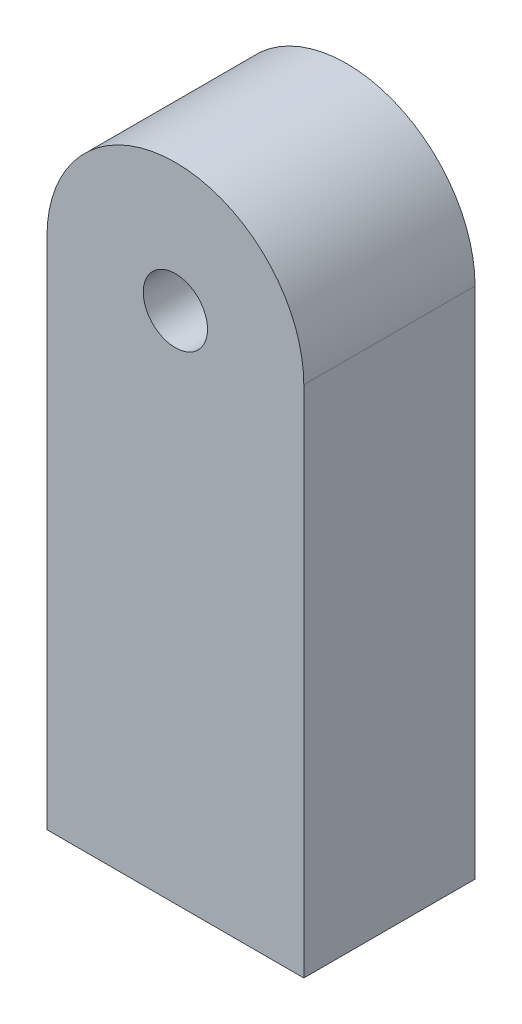
from build123d import *

# Parameters (mm, degrees)
SKETCH2_W           = 38.1
SKETCH2_H           = 25.4
BOSS_EXTRUDE1_DEPTH = 76.2
SKETCH3_W           = 19.05
SKETCH3_H           = 25.4
REVOLVE1_ANGLE      = 180
SKETCH4_R           = 4.7625
CUT_EXTRUDE1_DEPTH  = 101.40231571


with BuildPart() as part:
    # Sketch2 → Boss-Extrude1 (new body)
    with BuildSketch(Plane(origin=(0, 0, 0), x_dir=(1, 0, 0), z_dir=(0, 1, 0))):
        Rectangle(SKETCH2_W, SKETCH2_H)
    extrude(amount=BOSS_EXTRUDE1_DEPTH)

    # Sketch3 → Revolve1 (revolve)
    with BuildSketch(Plane(origin=(0, 76.2, 0), x_dir=(1, 0, 0), z_dir=(0, 1, 0))):
        with Locations((9.525, 0)):
            Rectangle(SKETCH3_W, SKETCH3_H)
    revolve(axis=Axis((0, 76.2, -12.7), (0, 0, 1)), revolution_arc=REVOLVE1_ANGLE)

    # Sketch4 → Cut-Extrude1 (cut, through all)
    with BuildSketch(Plane.XY.offset(12.7)):
        with Locations((0, 76.2)):
            Circle(SKETCH4_R)
    extrude(amount=-CUT_EXTRUDE1_DEPTH, mode=Mode.SUBTRACT)


solid = part.part
